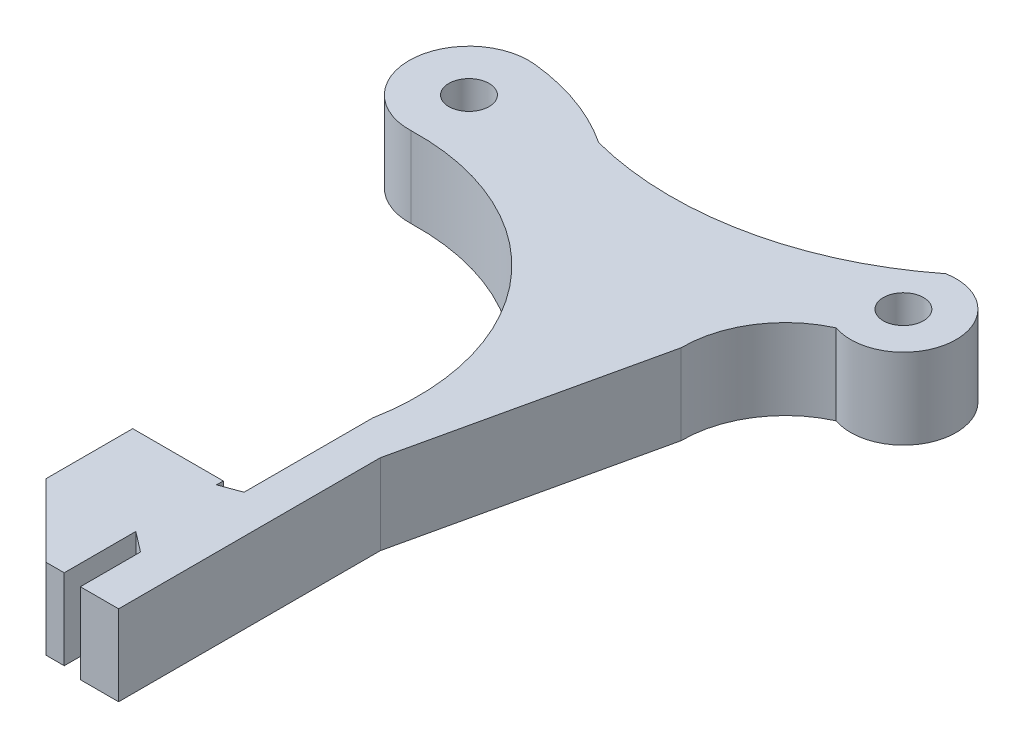
from build123d import *

# Parameters (mm, degrees)
BOSS_EXTRUDE2_DEPTH   = 10
BOSS_EXTRUDE2_2_DEPTH = 10
SKETCH4_R             = 2.5
BOSS_EXTRUDE3_DEPTH   = 10
SKETCH8_R             = 22.839298689
CUT_EXTRUDE1_DEPTH    = 10


with BuildPart() as part:
    # Sketch1 → Boss-Extrude2 (new body)
    with BuildSketch(Plane(origin=(0, 0, 0), x_dir=(1, 0, 0), z_dir=(0, 1, 0))):
        Polygon((-26.25, 10.75), (-15, 10.75), (-15, 0), (-23.984756923, -9), (-26.25, -9), (-26.25, -0.114272299), (-29.438415679, -2.555067389), (-29.438415679, 11.073293435), (-26.25, 9.911985917), align=None)
    extrude(amount=BOSS_EXTRUDE2_DEPTH)

    # Sketch8 → Cut-Extrude1 (cut)
    with BuildSketch(Plane(origin=(0, 0, 0), x_dir=(1, 0, 0), z_dir=(0, 1, 0))):
        with Locations((-20.905433381, 4.192616326)):
            Circle(SKETCH8_R)
    extrude(amount=CUT_EXTRUDE1_DEPTH, mode=Mode.SUBTRACT)


with BuildPart() as body_2:
    # Sketch1 → Boss-Extrude2 2 (new body)
    with BuildSketch(Plane(origin=(0, 0, 0), x_dir=(1, 0, 0), z_dir=(0, 1, 0))):
        Polygon((26.25, 10.75), (26.25, 9.911985917), (29.438415679, 11.073293435), (29.438415679, -2.555067389), (26.25, -0.114272299), (26.25, -9), (23.984756923, -9), (15, 0), (15, 10.75), align=None)
    extrude(amount=BOSS_EXTRUDE2_2_DEPTH)

    # Sketch4 → Boss-Extrude3 (add)
    with BuildSketch(Plane(origin=(0, 0, 0), x_dir=(1, 0, 0), z_dir=(0, 1, 0))):
        with BuildLine():
            Line((28.75, -9.5), (33.5, -9.5))
            Line((33.5, -9.5), (33.5, 22.996479512))
            Line((33.5, 22.996479512), (40.345191882, 53.478179684))
            ThreePointArc((40.345191882, 53.478179684), (42.346706654, 60.478565285), (47.83611753, 65.261642557))
            ThreePointArc((47.83611753, 65.261642557), (56.530633029, 70.937419635), (48.815741717, 77.886484122))
            ThreePointArc((48.815741717, 77.886484122), (31.869937483, 69.990732218), (13.180106847, 70.430516322))
            ThreePointArc((13.180106847, 70.430516322), (7.243272391, 73.413222616), (0.765261217, 74.88899747))
            ThreePointArc((0.765261217, 74.88899747), (-7.423605548, 67.770164785), (0.226137573, 60.074922886))
            ThreePointArc((0.226137573, 60.074922886), (22.453224616, 50.257390562), (28.75, 26.78873148))
            Line((28.75, 26.78873148), (28.75, -9.5))
        make_face()
        with Locations(Location((0, 67.5, 0), (0, 0, 270))):
            Circle(SKETCH4_R, mode=Mode.SUBTRACT)
        with Locations(Location((50, 71.444163901, 0), (0, 0, 270))):
            Circle(SKETCH4_R, mode=Mode.SUBTRACT)
    extrude(amount=BOSS_EXTRUDE3_DEPTH)


solid = body_2.part
